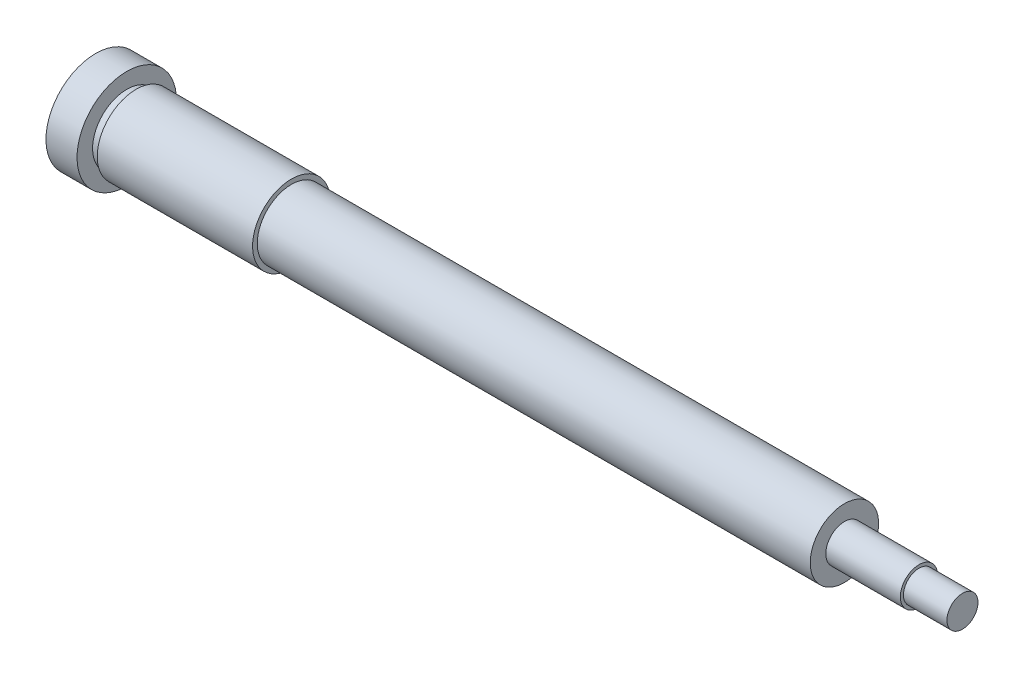
from build123d import *


with BuildPart() as part:
    # Sketch1 → Revolve1 (revolve)
    with BuildSketch(Plane.XY):
        Polygon((0, 0), (0, 16), (10, 16), (10, 11), (13, 11), (13, 12.5), (63, 12.5), (63, 11), (241, 11), (241, 6), (265, 6), (265, 5), (279, 5), (279, 0), align=None)
    revolve(axis=Axis((279, 0, 0), (-1, 0, 0)))


solid = part.part
